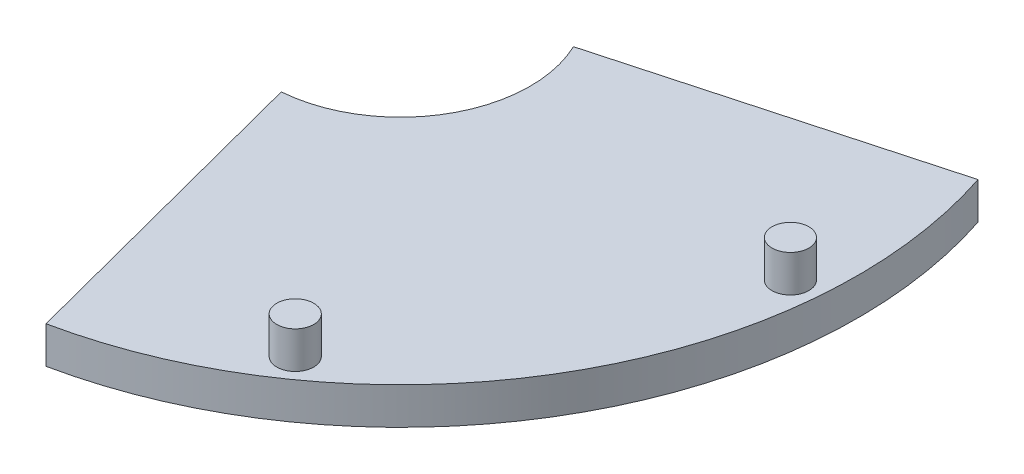
from build123d import *

# Parameters (mm, degrees)
SKETCH_1_R           = 1.5
EXTRUDE_1_DEPTH      = 3
EXTRUDE_2_DEPTH      = 3
EXTRUDE_2_DEPTH_BACK = 3
SKETCH_2_R           = 1.5


with BuildPart() as part:
    # 草图1 → 凸台-拉伸1 (new body)
    with BuildSketch(Plane(origin=(0, 0, 0), x_dir=(1, 0, 0), z_dir=(0, 1, 0))):
        with BuildLine():
            Line((-96.621430383, 38.303370954), (-70.818390196, 45.39148714))
            ThreePointArc((-70.818390196, 45.39148714), (-73.937652642, 15.166954083), (-98.553234864, -2.646672965))
            Line((-98.553234864, -2.646672965), (-105.316266275, 23.243473425))
            ThreePointArc((-105.316266275, 23.243473425), (-97.009577473, 28.487536095), (-96.621430383, 38.303370954))
        make_face()
        with Locations((-86.118640655, 5.183838281)):
            Circle(SKETCH_1_R, mode=Mode.SUBTRACT)
        with Locations((-71.373114162, 30.69577881)):
            Circle(SKETCH_1_R, mode=Mode.SUBTRACT)
    extrude(amount=EXTRUDE_1_DEPTH)

    # 草图2 → 凸台-拉伸2 (add, two sides: drawn at the far end of the back side and taken through both)
    with BuildSketch(Plane(origin=(0, 3, 0), x_dir=(1, 0, 0), z_dir=(0, 1, 0)).offset(-EXTRUDE_2_DEPTH_BACK)):
        with Locations((-71.373114162, 30.69577881)):
            Circle(SKETCH_2_R)
        with Locations((-86.118640655, 5.183838281)):
            Circle(SKETCH_2_R)
    extrude(amount=EXTRUDE_2_DEPTH + EXTRUDE_2_DEPTH_BACK)


solid = part.part
